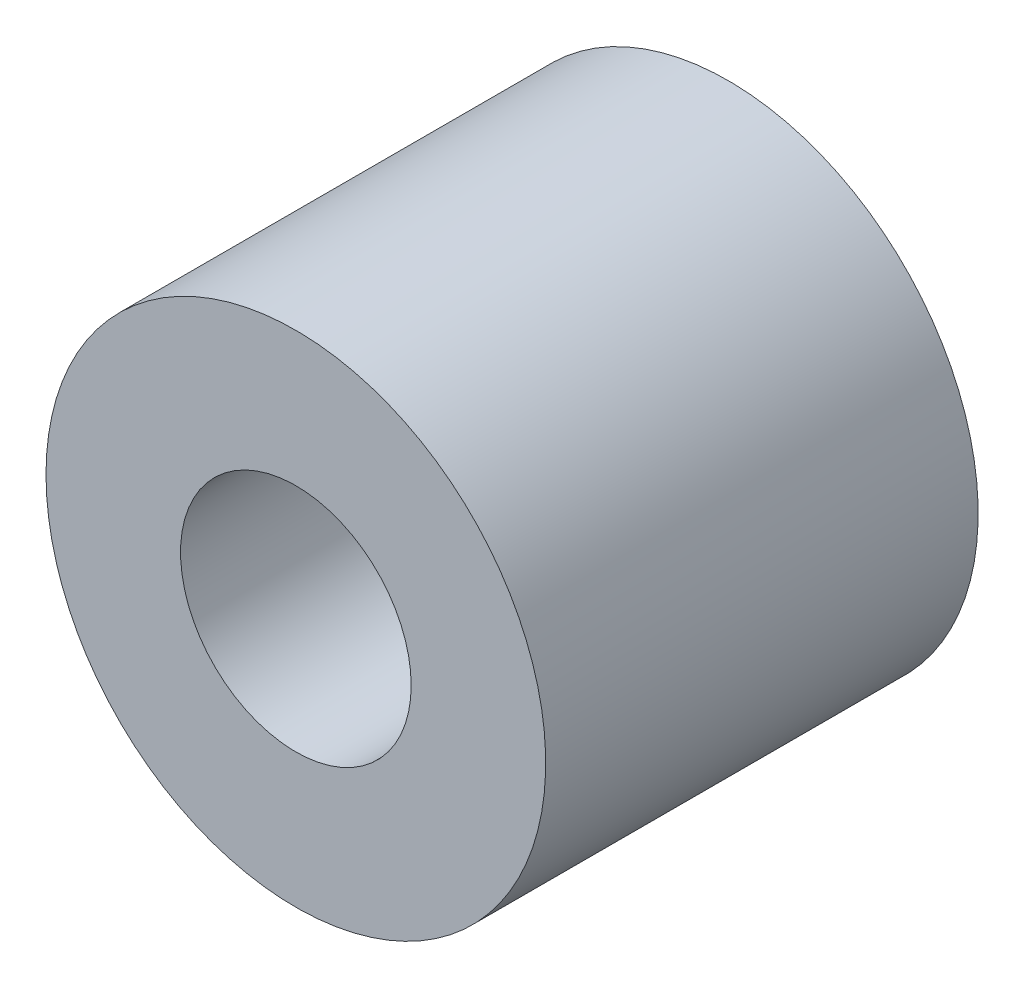
from build123d import *

# Parameters (mm, degrees)
SKETCH1_R           = 26
BOSS_EXTRUDE1_DEPTH = 45
SKETCH2_R           = 12
CUT_EXTRUDE1_DEPTH  = 59.111960903


with BuildPart() as part:
    # Sketch1 → Boss-Extrude1 (new body)
    with BuildSketch(Plane.XY):
        with Locations(Location((0, 0, 0), (0, 0, 180))):
            Circle(SKETCH1_R)
    extrude(amount=BOSS_EXTRUDE1_DEPTH)

    # Sketch2 → Cut-Extrude1 (cut, through all)
    with BuildSketch(Plane.XY.offset(45)):
        Circle(SKETCH2_R)
    extrude(amount=-CUT_EXTRUDE1_DEPTH, mode=Mode.SUBTRACT)


solid = part.part
